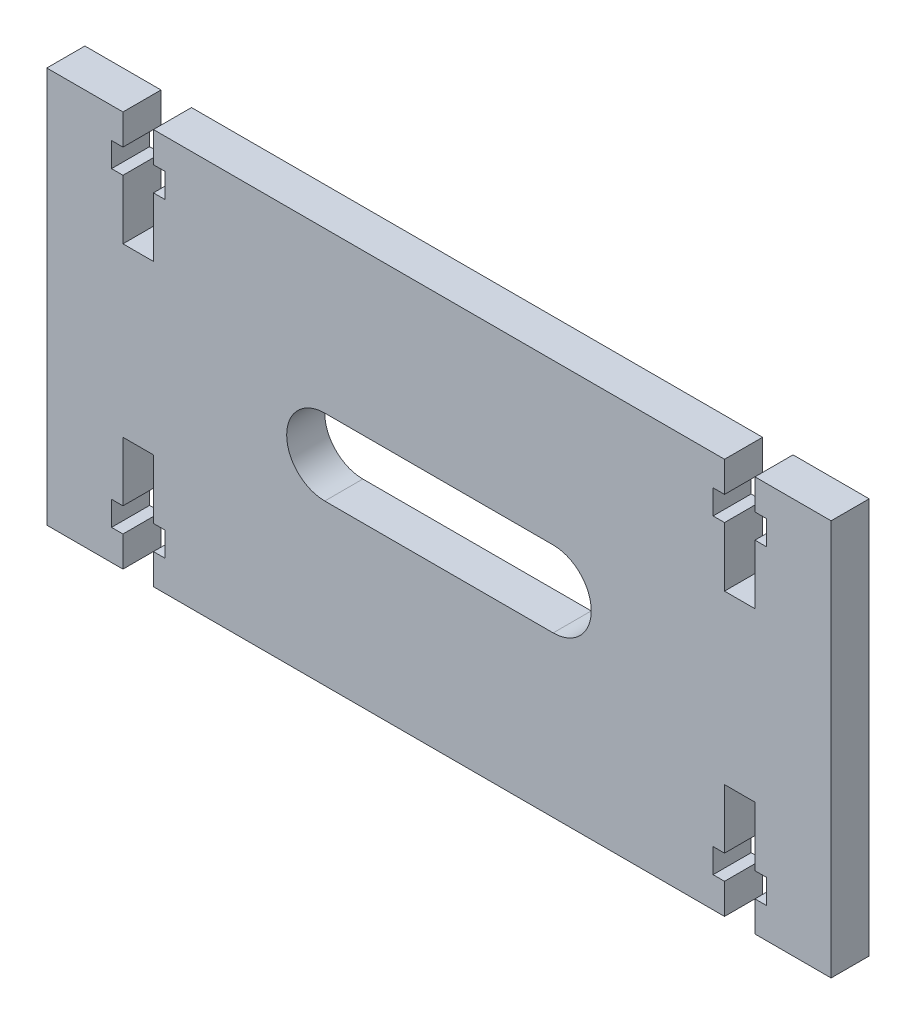
from build123d import *

# Parameters (mm, degrees)
SKETCH1_W           = 103
SKETCH1_H           = 52
BOSS_EXTRUDE1_DEPTH = 5
CUT_EXTRUDE1_DEPTH  = 10
CUT_EXTRUDE2_DEPTH  = 10


with BuildPart() as part:
    # Sketch1 → Boss-Extrude1 (new body)
    with BuildSketch(Plane.XY):
        Rectangle(SKETCH1_W, SKETCH1_H)
    extrude(amount=BOSS_EXTRUDE1_DEPTH)

    # Sketch2 → Cut-Extrude1 (cut)
    with BuildSketch(Plane.XY.offset(5)):
        Polygon((41.5, -26), (41.5, -22), (43, -22), (43, -18.8), (41.5, -18.8), (41.5, -11), (37.5, -11), (37.5, -18.8), (36, -18.8), (36, -22), (37.5, -22), (37.5, -26), align=None)
        Polygon((37.5, 26), (41.5, 26), (41.5, 22), (43, 22), (43, 18.8), (41.5, 18.8), (41.5, 11), (37.5, 11), (37.5, 18.8), (36, 18.8), (36, 22), (37.5, 22), align=None)
        Polygon((-37.5, -26), (-41.5, -26), (-41.5, -22), (-43, -22), (-43, -18.8), (-41.5, -18.8), (-41.5, -11), (-37.5, -11), (-37.5, -18.8), (-36, -18.8), (-36, -22), (-37.5, -22), align=None)
        Polygon((-41.5, 26), (-41.5, 22), (-43, 22), (-43, 18.8), (-41.5, 18.8), (-41.5, 11), (-37.5, 11), (-37.5, 18.8), (-36, 18.8), (-36, 22), (-37.5, 22), (-37.5, 26), align=None)
    extrude(amount=-CUT_EXTRUDE1_DEPTH, mode=Mode.SUBTRACT)

    # Sketch3 → Cut-Extrude2 (cut)
    with BuildSketch(Plane(origin=(0, 0, 0), x_dir=(-1, 0, 0), z_dir=(0, 0, -1))):
        with BuildLine():
            Line((-15, 5), (15, 5))
            ThreePointArc((15, 5), (20, 0), (15, -5))
            Line((15, -5), (-15, -5))
            ThreePointArc((-15, -5), (-20, 0), (-15, 5))
        make_face()
    extrude(amount=-CUT_EXTRUDE2_DEPTH, mode=Mode.SUBTRACT)


solid = part.part
